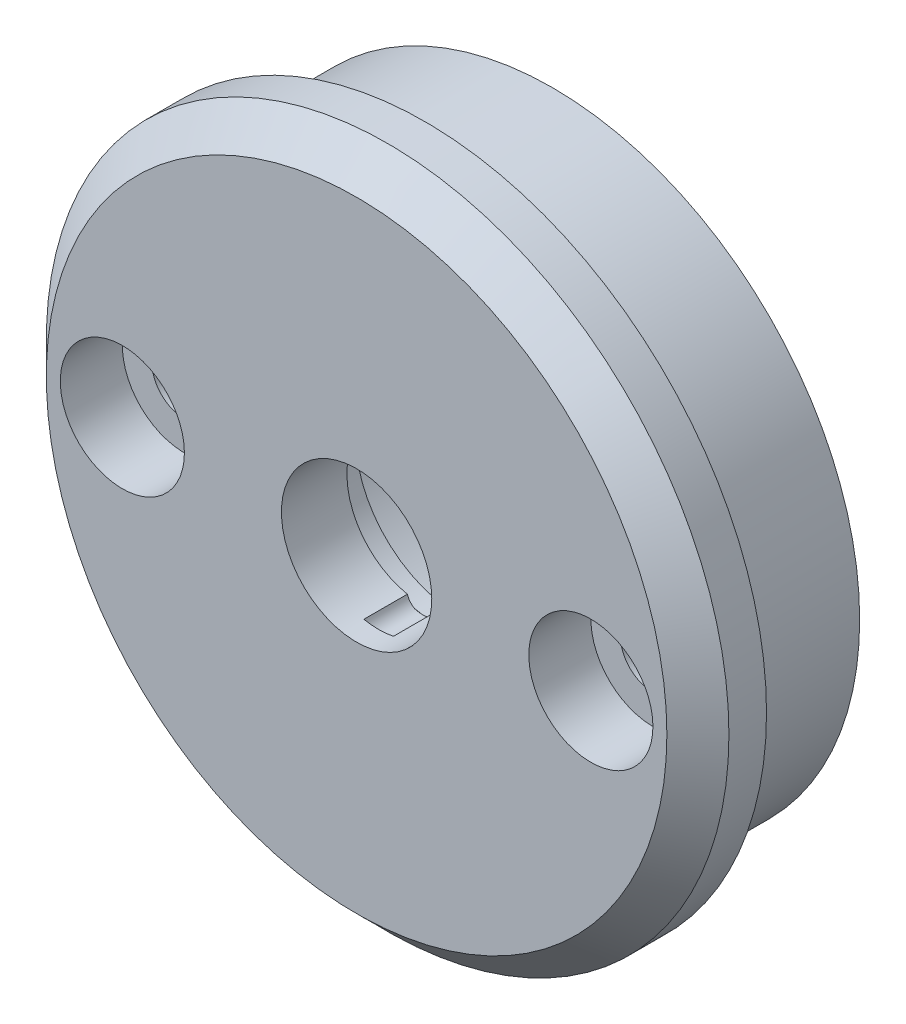
from build123d import *

# Parameters (mm, degrees)
SKETCH1_R               = 9.9
BOSS_EXTRUDE1_DEPTH     = 4.1024
SKETCH3_R               = 11
BOSS_EXTRUDE2_DEPTH     = 2.2114
CUT_EXTRUDE1_DEPTH      = 17.088184663
CUT_EXTRUDE1_DEPTH_BACK = 1.5
SKETCH6_R               = 0.5
CHAMFER1_SIZE           = 1
SKETCH7_R               = 2
CUT_EXTRUDE2_DEPTH      = 2
SKETCH8_R               = 1.05
CUT_EXTRUDE3_DEPTH      = 17.143384727
SKETCH9_R               = 6.003028119
CUT_EXTRUDE4_DEPTH      = 3


with BuildPart() as part:
    # Sketch1 → Boss-Extrude1 (new body)
    with BuildSketch(Plane.XY.offset(2.5)):
        with Locations(Location((0, 0, 0), (0, 0, 180))):
            Circle(SKETCH1_R)
    extrude(amount=BOSS_EXTRUDE1_DEPTH)

    # Sketch3 → Boss-Extrude2 (add)
    with BuildSketch(Plane.XY.offset(6.6024)):
        Circle(SKETCH3_R)
    extrude(amount=BOSS_EXTRUDE2_DEPTH)

    # Sketch4 → Cut-Revolve2 (revolve, cut)
    with BuildSketch(Plane(origin=(0, 0, 0), x_dir=(0, 0, -1), z_dir=(1, 0, 0)), mode=Mode.PRIVATE) as cut_revolve2_sk:
        with BuildLine():
            Line((-6.113239385, 3.350496042), (0, 3.350496042))
            Line((0, 3.350496042), (0, 0))
            Line((0, 0), (-8.8138, 0))
            Line((-8.8138, 0), (-8.8138, 2.4225))
            Line((-8.8138, 2.4225), (-6.7024, 2.4225))
            Line((-6.7024, 2.4225), (-6.7024, 2.673729766))
            Line((-6.7024, 2.673729766), (-6.644568783, 2.814399725))
            ThreePointArc((-6.644568783, 2.814399725), (-6.379015778, 3.082558584), (-6.113239385, 3.350496042))
        make_face()
    revolve(cut_revolve2_sk.sketch.rotate(Axis((0, 0, 8.8138), (0, 0, -1)), 90), axis=Axis((0, 0, 8.8138), (0, 0, -1)), mode=Mode.SUBTRACT)

    # Sketch6 → Cut-Extrude1 (cut, two sides: drawn at the far end of the back side and taken through both)
    with BuildSketch(Plane(origin=(0, 0, 6.6024), x_dir=(-1, 0, 0), z_dir=(0, 0, -1)).offset(-CUT_EXTRUDE1_DEPTH_BACK)):
        with Locations((1.2e-08, -2.2225)):
            Circle(SKETCH6_R)
    extrude(amount=CUT_EXTRUDE1_DEPTH + CUT_EXTRUDE1_DEPTH_BACK, mode=Mode.SUBTRACT)

    # Chamfer1
    chamfer1_edges = [part.edges().sort_by_distance(p)[0] for p in [
        (-11, 0, 8.8138),
    ]]
    chamfer(chamfer1_edges, length=CHAMFER1_SIZE)

    # Sketch7 → Cut-Extrude2 (cut)
    with BuildSketch(Plane.XY.offset(8.8138)):
        with Locations((-7.549511775, 0.085860102)):
            Circle(SKETCH7_R)
        with Locations((7.55, 0)):
            Circle(SKETCH7_R)
    extrude(amount=-CUT_EXTRUDE2_DEPTH, mode=Mode.SUBTRACT)

    # Sketch8 → Cut-Extrude3 (cut, through all)
    with BuildSketch(Plane.XY.offset(6.8138)):
        with Locations((-7.549511775, 0.085860102)):
            Circle(SKETCH8_R)
        with Locations((7.55, 0)):
            Circle(SKETCH8_R)
    extrude(amount=-CUT_EXTRUDE3_DEPTH, mode=Mode.SUBTRACT)

    # Sketch9 → Cut-Extrude4 (cut)
    with BuildSketch(Plane(origin=(0, 0, 2.5), x_dir=(-1, 0, 0), z_dir=(0, 0, -1))):
        Circle(SKETCH9_R)
    extrude(amount=-CUT_EXTRUDE4_DEPTH, mode=Mode.SUBTRACT)


solid = part.part
